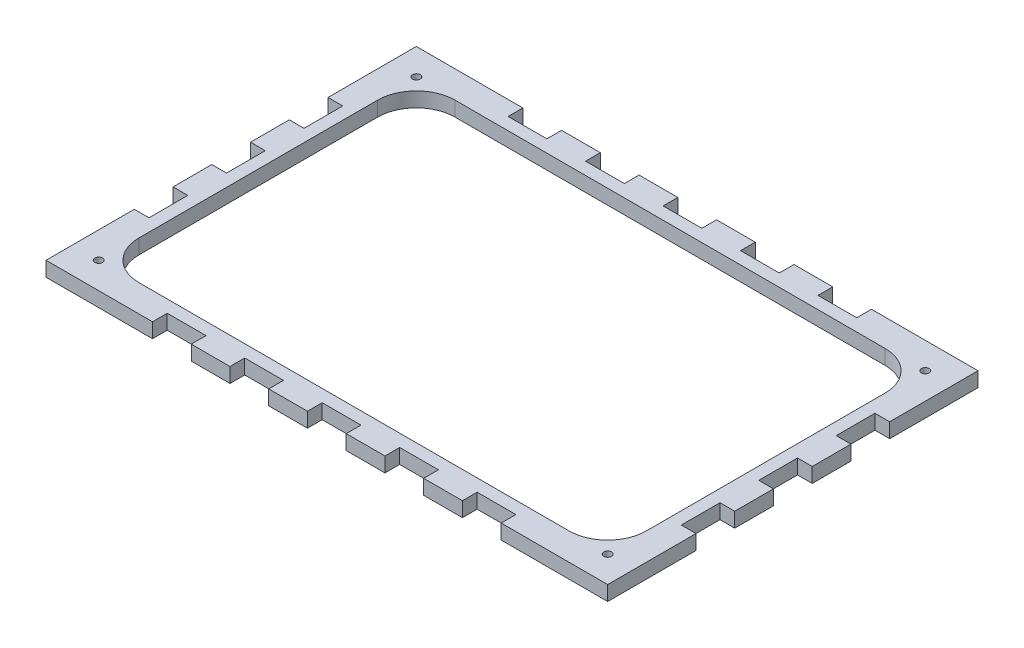
from build123d import *

# Parameters (mm, degrees)
SKETCH1_W           = 145
SKETCH1_H           = 95.6
BOSS_EXTRUDE1_DEPTH = 3.8
SKETCH2_W           = 131
SKETCH2_H           = 81.6
CUT_EXTRUDE1_DEPTH  = 174.720465116
FILLET1_R           = 10
SKETCH3_R           = 1
CUT_EXTRUDE2_DEPTH  = 174.720465116
SKETCH8_W           = 10
SKETCH8_H           = 3.8
CUT_EXTRUDE5_DEPTH  = 174.720465116
LPATTERN3_COUNT     = 4
LPATTERN3_PITCH     = 20
LPATTERN3_COL_COUNT = 4
LPATTERN3_COL_PITCH = 20
SKETCH9_W           = 3.8
SKETCH9_H           = 10
CUT_EXTRUDE6_DEPTH  = 174.720465116
LPATTERN4_COUNT     = 3
LPATTERN4_PITCH     = 20
LPATTERN4_COL_COUNT = 3
LPATTERN4_COL_PITCH = 20
SKETCH11_W          = 3.8
SKETCH11_H          = 10
SKETCH11_W_2        = 10
SKETCH11_H_2        = 3.8
BOSS_EXTRUDE4_DEPTH = 3.8


with BuildPart() as part:
    # Sketch1 → Boss-Extrude1 (new body)
    with BuildSketch(Plane(origin=(0, 0, 0), x_dir=(1, 0, 0), z_dir=(0, 1, 0))):
        with Locations((72.5, -47.8)):
            Rectangle(SKETCH1_W, SKETCH1_H)
    extrude(amount=BOSS_EXTRUDE1_DEPTH)

    # Sketch2 → Cut-Extrude1 (cut, through all)
    with BuildSketch(Plane(origin=(0, 3.8, 0), x_dir=(1, 0, 0), z_dir=(0, 1, 0))):
        with Locations((72.5, -47.8)):
            Rectangle(SKETCH2_W, SKETCH2_H)
    extrude(amount=-CUT_EXTRUDE1_DEPTH, mode=Mode.SUBTRACT)

    # Fillet1
    fillet1_edges = [part.edges().sort_by_distance(p)[0] for p in [
        (7, 1.9, 88.6),
        (7, 1.9, 7),
        (138, 1.9, 7),
        (138, 1.9, 88.6),
    ]]
    fillet(fillet1_edges, radius=FILLET1_R)

    # Sketch3 → Cut-Extrude2 (cut, through all)
    with BuildSketch(Plane.XZ):
        with Locations(Location((6.8, 88.8, 0), (0, 0, 270))):
            Circle(SKETCH3_R)
        with Locations(Location((138.2, 88.8, 0), (0, 0, 270))):
            Circle(SKETCH3_R)
        with Locations(Location((138.2, 6.8, 0), (0, 0, 270))):
            Circle(SKETCH3_R)
        with Locations(Location((6.8, 6.8, 0), (0, 0, 270))):
            Circle(SKETCH3_R)
    extrude(amount=-CUT_EXTRUDE2_DEPTH, mode=Mode.SUBTRACT)

    # Sketch8 → Cut-Extrude5 (cut, through all)
    with BuildSketch(Plane(origin=(0, 0, 0), x_dir=(-1, 0, 0), z_dir=(0, -1, 0))):
        with Locations((-72.5, -93.7)):
            Rectangle(SKETCH8_W, SKETCH8_H)
        with Locations((-72.5, -1.9)):
            Rectangle(SKETCH8_W, SKETCH8_H)
    cut_extrude5 = extrude(amount=-CUT_EXTRUDE5_DEPTH, mode=Mode.SUBTRACT)

    # LPattern3: Cut-Extrude5 ×4
    with Locations(*[(i * LPATTERN3_PITCH, 0, 0) for i in range(1, LPATTERN3_COUNT)]):
        add(cut_extrude5, mode=Mode.SUBTRACT)

    # LPattern3 col: Cut-Extrude5 ×4
    with Locations(*[(-i * LPATTERN3_COL_PITCH, 0, 0) for i in range(1, LPATTERN3_COL_COUNT)]):
        add(cut_extrude5, mode=Mode.SUBTRACT)

    # Sketch9 → Cut-Extrude6 (cut, through all)
    with BuildSketch(Plane(origin=(0, 0, 0), x_dir=(-1, 0, 0), z_dir=(0, -1, 0))):
        with Locations((-1.9, -47.8)):
            Rectangle(SKETCH9_W, SKETCH9_H)
        with Locations((-143.1, -47.8)):
            Rectangle(SKETCH9_W, SKETCH9_H)
    cut_extrude6 = extrude(amount=-CUT_EXTRUDE6_DEPTH, mode=Mode.SUBTRACT)

    # LPattern4: Cut-Extrude6 ×3
    with Locations(*[(0, 0, i * LPATTERN4_PITCH) for i in range(1, LPATTERN4_COUNT)]):
        add(cut_extrude6, mode=Mode.SUBTRACT)

    # LPattern4 col: Cut-Extrude6 ×3
    with Locations(*[(0, 0, -i * LPATTERN4_COL_PITCH) for i in range(1, LPATTERN4_COL_COUNT)]):
        add(cut_extrude6, mode=Mode.SUBTRACT)

    # Sketch11 → Boss-Extrude4 (add, through all)
    with BuildSketch(Plane(origin=(0, 0, 0), x_dir=(-1, 0, 0), z_dir=(0, -1, 0))):
        with Locations((-143.1, -87.8)):
            Rectangle(SKETCH11_W, SKETCH11_H)
        with Locations((-132.5, -93.7)):
            Rectangle(SKETCH11_W_2, SKETCH11_H_2)
        with Locations((-132.5, -1.9)):
            Rectangle(SKETCH11_W_2, SKETCH11_H_2)
        with Locations((-143.1, -7.8)):
            Rectangle(SKETCH11_W, SKETCH11_H)
        with Locations((-1.9, -7.8)):
            Rectangle(SKETCH11_W, SKETCH11_H)
        with Locations((-12.5, -1.9)):
            Rectangle(SKETCH11_W_2, SKETCH11_H_2)
        with Locations((-1.9, -87.8)):
            Rectangle(SKETCH11_W, SKETCH11_H)
        with Locations((-12.5, -93.7)):
            Rectangle(SKETCH11_W_2, SKETCH11_H_2)
    extrude(amount=-BOSS_EXTRUDE4_DEPTH)


solid = part.part
